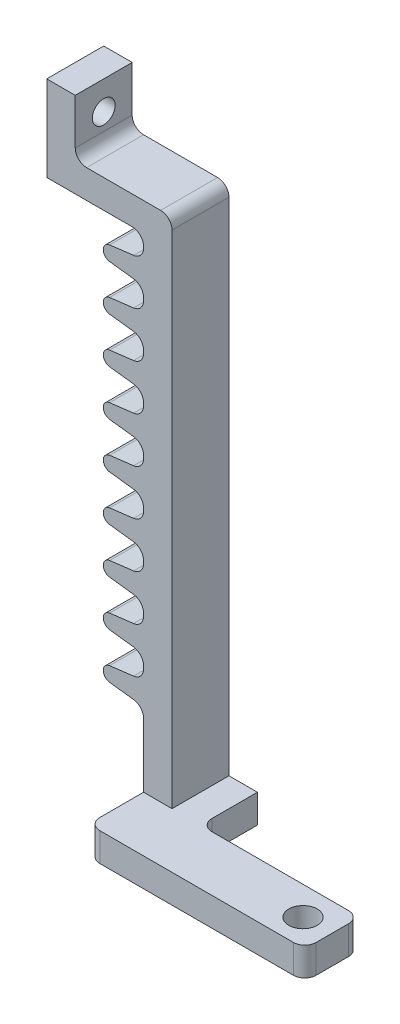
from build123d import *

# Parameters (mm, degrees)
BOSS_EXTRUDE1_DEPTH    = 7
SKETCH2_W              = 5
SKETCH2_H              = 10
BOSS_EXTRUDE2_DEPTH    = 95
SKETCH15_R             = 3.5
CUT_EXTRUDE3_DEPTH     = 7
SKETCH18_W             = 10
SKETCH18_H             = 5
BOSS_EXTRUDE3_DEPTH    = 34
BOSS_EXTRUDE4_DEPTH    = 10
FILLET1_R              = 2
FILLET2_R              = 2
LPATTERN2_COUNT        = 9
LPATTERN2_PITCH        = 8
FILLET1_OF_LPATTERN2_R = 2
SKETCH20_R             = 2.5
CUT_EXTRUDE4_DEPTH     = 10
CIRPATTERN2_COUNT      = 4
SKETCH22_W             = 135.679550384
SKETCH22_H             = 112.96527187
CUT_EXTRUDE5_DEPTH     = 61.740758688
BOSS_EXTRUDE5_START    = 5
SKETCH23_R             = 2.5
BOSS_EXTRUDE5_DEPTH    = 5
CUT_EXTRUDE6_START     = -10
CUT_EXTRUDE6_DEPTH     = 10
SKETCH27_W             = 10
SKETCH27_H             = 5
BOSS_EXTRUDE6_DEPTH    = 5
SKETCH28_W             = 5
SKETCH28_H             = 10
BOSS_EXTRUDE7_DEPTH    = 10
SKETCH29_R             = 2
CUT_EXTRUDE7_DEPTH     = 5
FILLET3_R              = 2


with BuildPart() as part:
    # Sketch1 → Boss-Extrude1 (new body)
    with BuildSketch(Plane(origin=(0, 0, 0), x_dir=(1, 0, 0), z_dir=(0, 1, 0))):
        with BuildLine():
            Line((-8, 56.940758688), (-8, 59.740758688))
            ThreePointArc((-8, 59.740758688), (-7.414213562, 61.154972251), (-6, 61.740758688))
            Line((-6, 61.740758688), (6, 61.740758688))
            ThreePointArc((6, 61.740758688), (7.414213562, 61.154972251), (8, 59.740758688))
            Line((8, 59.740758688), (8, 56.940758688))
            ThreePointArc((8, 56.940758688), (22.004297361, 53.123073119), (34.606342345, 45.920050844))
            Line((34.606342345, 45.920050844), (36.586241332, 47.899949831))
            ThreePointArc((36.586241332, 47.899949831), (38.000454895, 48.485736269), (39.414668457, 47.899949831))
            Line((39.414668457, 47.899949831), (47.899949831, 39.414668457))
            ThreePointArc((47.899949831, 39.414668457), (48.485736269, 38.000454895), (47.899949831, 36.586241332))
            Line((47.899949831, 36.586241332), (45.920050844, 34.606342345))
            ThreePointArc((45.920050844, 34.606342345), (53.123073119, 22.004297361), (56.940758688, 8))
            Line((56.940758688, 8), (59.740758688, 8))
            ThreePointArc((59.740758688, 8), (61.154972251, 7.414213562), (61.740758688, 6))
            Line((61.740758688, 6), (61.740758688, -6))
            ThreePointArc((61.740758688, -6), (61.154972251, -7.414213562), (59.740758688, -8))
            Line((59.740758688, -8), (56.940758688, -8))
            ThreePointArc((56.940758688, -8), (53.123073119, -22.004297361), (45.920050844, -34.606342345))
            Line((45.920050844, -34.606342345), (47.899949831, -36.586241332))
            ThreePointArc((47.899949831, -36.586241332), (48.485736269, -38.000454895), (47.899949831, -39.414668457))
            Line((47.899949831, -39.414668457), (39.414668457, -47.899949831))
            ThreePointArc((39.414668457, -47.899949831), (38.000454895, -48.485736269), (36.586241332, -47.899949831))
            Line((36.586241332, -47.899949831), (34.606342345, -45.920050844))
            ThreePointArc((34.606342345, -45.920050844), (22.004297361, -53.123073119), (8, -56.940758688))
            Line((8, -56.940758688), (8, -59.740758688))
            ThreePointArc((8, -59.740758688), (7.414213562, -61.154972251), (6, -61.740758688))
            Line((6, -61.740758688), (-6, -61.740758688))
            ThreePointArc((-6, -61.740758688), (-7.414213562, -61.154972251), (-8, -59.740758688))
            Line((-8, -59.740758688), (-8, -56.940758688))
            ThreePointArc((-8, -56.940758688), (-22.004297361, -53.123073119), (-34.606342345, -45.920050844))
            Line((-34.606342345, -45.920050844), (-36.586241332, -47.899949831))
            ThreePointArc((-36.586241332, -47.899949831), (-38.000454895, -48.485736269), (-39.414668457, -47.899949831))
            Line((-39.414668457, -47.899949831), (-47.899949831, -39.414668457))
            ThreePointArc((-47.899949831, -39.414668457), (-48.485736269, -38.000454895), (-47.899949831, -36.586241332))
            Line((-47.899949831, -36.586241332), (-45.920050844, -34.606342345))
            ThreePointArc((-45.920050844, -34.606342345), (-53.123073119, -22.004297361), (-56.940758688, -8))
            Line((-56.940758688, -8), (-59.740758688, -8))
            ThreePointArc((-59.740758688, -8), (-61.154972251, -7.414213562), (-61.740758688, -6))
            Line((-61.740758688, -6), (-61.740758688, 6))
            ThreePointArc((-61.740758688, 6), (-61.154972251, 7.414213562), (-59.740758688, 8))
            Line((-59.740758688, 8), (-56.940758688, 8))
            ThreePointArc((-56.940758688, 8), (-53.123073119, 22.004297361), (-45.920050844, 34.606342345))
            Line((-45.920050844, 34.606342345), (-47.899949831, 36.586241332))
            ThreePointArc((-47.899949831, 36.586241332), (-48.485736269, 38.000454895), (-47.899949831, 39.414668457))
            Line((-47.899949831, 39.414668457), (-39.414668457, 47.899949831))
            ThreePointArc((-39.414668457, 47.899949831), (-38.000454895, 48.485736269), (-36.586241332, 47.899949831))
            Line((-36.586241332, 47.899949831), (-34.606342345, 45.920050844))
            ThreePointArc((-34.606342345, 45.920050844), (-22.004297361, 53.123073119), (-8, 56.940758688))
        make_face()
    extrude(amount=BOSS_EXTRUDE1_DEPTH)

    # Sketch2 → Boss-Extrude2 (add)
    with BuildSketch(Plane(origin=(0, 7, 0), x_dir=(1, 0, 0), z_dir=(0, 1, 0))):
        with Locations((19.5, 10)):
            Rectangle(SKETCH2_W, SKETCH2_H)
        with Locations((-19.5, 10)):
            Rectangle(SKETCH2_W, SKETCH2_H)
    extrude(amount=BOSS_EXTRUDE2_DEPTH)

    # Sketch15 → Cut-Extrude3 (cut)
    with BuildSketch(Plane.XZ):
        with Locations(Location((0, 0, 0), (0, 0, 270))):
            Circle(SKETCH15_R)
    extrude(amount=-CUT_EXTRUDE3_DEPTH, mode=Mode.SUBTRACT)

    # Sketch18 → Boss-Extrude3 (add)
    with BuildSketch(Plane(origin=(-17, 0, 0), x_dir=(0, 0, -1), z_dir=(1, 0, 0))):
        with Locations((10, 99.5)):
            Rectangle(SKETCH18_W, SKETCH18_H)
    extrude(amount=BOSS_EXTRUDE3_DEPTH)

    # Sketch19 → Boss-Extrude4 (add)
    with BuildSketch(Plane(origin=(0, 0, -15), x_dir=(-1, 0, 0), z_dir=(0, 0, -1))):
        with BuildLine():
            Line((-17, 93), (-11.04472309, 92.26878394))
            ThreePointArc((-11.04472309, 92.26878394), (-9.922197884, 91), (-11.04472309, 89.73121606))
            Line((-11.04472309, 89.73121606), (-17, 89))
            Line((-17, 89), (-17, 93))
        make_face()
    boss_extrude4 = extrude(amount=-BOSS_EXTRUDE4_DEPTH)

    # Fillet1
    fillet1_edges = [part.edges().sort_by_distance(p)[0] for p in [
        (17, 89, -10),
        (17, 93, -10),
    ]]
    fillet(fillet1_edges, radius=FILLET1_R)

    # Fillet2
    fillet2_edges = [part.edges().sort_by_distance(p)[0] for p in [
        (22, 102, -10),
        (-22, 102, -10),
        (-17, 97, -10),
        (17, 97, -10),
    ]]
    fillet(fillet2_edges, radius=FILLET2_R)

    # LPattern2: Boss-Extrude4 ×9
    with Locations(*[(0, -i * LPATTERN2_PITCH, 0) for i in range(1, LPATTERN2_COUNT)]):
        add(boss_extrude4)

    # Fillet1 of LPattern2
    fillet1_of_lpattern2_edges = [part.edges().sort_by_distance(p)[0] for p in [
        (17, 81, -10),
        (17, 85, -10),
        (17, 73, -10),
        (17, 77, -10),
        (17, 65, -10),
        (17, 69, -10),
        (17, 57, -10),
        (17, 61, -10),
        (17, 49, -10),
        (17, 53, -10),
        (17, 41, -10),
        (17, 45, -10),
        (17, 33, -10),
        (17, 37, -10),
        (17, 25, -10),
        (17, 29, -10),
    ]]
    fillet(fillet1_of_lpattern2_edges, radius=FILLET1_OF_LPATTERN2_R)

    # Sketch20 → Cut-Extrude4 (cut)
    with BuildSketch(Plane(origin=(0, 7, 0), x_dir=(1, 0, 0), z_dir=(0, 1, 0))):
        with Locations(Location((0, 50, 0), (0, 0, 270))):
            Circle(SKETCH20_R)
    cut_extrude4 = extrude(amount=-CUT_EXTRUDE4_DEPTH, mode=Mode.SUBTRACT)

    # CirPattern2: Cut-Extrude4 ×4 about axis
    cirpattern2_axis = Axis((0, 0, 0), (0, 1, 0))
    for i in range(1, CIRPATTERN2_COUNT):
        add(cut_extrude4.rotate(cirpattern2_axis, i * 360 / CIRPATTERN2_COUNT), mode=Mode.SUBTRACT)

    # Sketch22 → Cut-Extrude5 (cut)
    with BuildSketch(Plane(origin=(0, 0, 0), x_dir=(0, 0, -1), z_dir=(1, 0, 0))):
        with Locations((-0.132373771, 50.371775874)):
            Rectangle(SKETCH22_W, SKETCH22_H)
    extrude(amount=-CUT_EXTRUDE5_DEPTH, mode=Mode.SUBTRACT)

    # Sketch23 → Boss-Extrude5 (add)
    with BuildSketch(Plane(origin=(0, 7, 0), x_dir=(1, 0, 0), z_dir=(0, 1, 0)).offset(BOSS_EXTRUDE5_START)):
        with BuildLine():
            Line((55, 3), (55, -2.687123684))
            ThreePointArc((55, -2.687123684), (54.414213562, -4.101337246), (53, -4.687123684))
            Line((53, -4.687123684), (19, -4.687123684))
            ThreePointArc((19, -4.687123684), (17.585786438, -4.101337246), (17, -2.687123684))
            Line((17, -2.687123684), (17, 5))
            Line((17, 5), (53, 5))
            ThreePointArc((53, 5), (54.414213562, 4.414213562), (55, 3))
        make_face()
        with Locations(Location((50, 0, 0), (0, 0, 270))):
            Circle(SKETCH23_R, mode=Mode.SUBTRACT)
    extrude(amount=-BOSS_EXTRUDE5_DEPTH)

    # Sketch26 → Cut-Extrude6 (cut)
    with BuildSketch(Plane(origin=(0, 7, 0), x_dir=(1, 0, 0), z_dir=(0, 1, 0)).offset(CUT_EXTRUDE6_START)):
        with BuildLine():
            Line((6, 61.740758688), (0, 61.740758688))
            Line((0, 61.740758688), (0, 52.5))
            ThreePointArc((0, 52.5), (2.5, 50), (0, 47.5))
            Line((0, 47.5), (0, 3.5))
            ThreePointArc((0, 3.5), (3.5, 0), (0, -3.5))
            Line((0, -3.5), (0, -47.5))
            ThreePointArc((0, -47.5), (2.5, -50), (0, -52.5))
            Line((0, -52.5), (0, -61.740758688))
            Line((0, -61.740758688), (6, -61.740758688))
            ThreePointArc((6, -61.740758688), (7.414213562, -61.154972251), (8, -59.740758688))
            Line((8, -59.740758688), (8, -56.940758688))
            ThreePointArc((8, -56.940758688), (22.004297361, -53.123073119), (34.606342345, -45.920050844))
            Line((34.606342345, -45.920050844), (36.586241332, -47.899949831))
            ThreePointArc((36.586241332, -47.899949831), (38.000454895, -48.485736269), (39.414668457, -47.899949831))
            Line((39.414668457, -47.899949831), (47.899949831, -39.414668457))
            ThreePointArc((47.899949831, -39.414668457), (48.485736269, -38.000454895), (47.899949831, -36.586241332))
            Line((47.899949831, -36.586241332), (45.920050844, -34.606342345))
            ThreePointArc((45.920050844, -34.606342345), (53.123073119, -22.004297361), (56.940758688, -8))
            Line((56.940758688, -8), (59.740758688, -8))
            ThreePointArc((59.740758688, -8), (61.154972251, -7.414213562), (61.740758688, -6))
            Line((61.740758688, -6), (61.740758688, 6))
            ThreePointArc((61.740758688, 6), (61.154972251, 7.414213562), (59.740758688, 8))
            Line((59.740758688, 8), (56.940758688, 8))
            ThreePointArc((56.940758688, 8), (53.123073119, 22.004297361), (45.920050844, 34.606342345))
            Line((45.920050844, 34.606342345), (47.899949831, 36.586241332))
            ThreePointArc((47.899949831, 36.586241332), (48.485736269, 38.000454895), (47.899949831, 39.414668457))
            Line((47.899949831, 39.414668457), (39.414668457, 47.899949831))
            ThreePointArc((39.414668457, 47.899949831), (38.000454895, 48.485736269), (36.586241332, 47.899949831))
            Line((36.586241332, 47.899949831), (34.606342345, 45.920050844))
            ThreePointArc((34.606342345, 45.920050844), (22.004297361, 53.123073119), (8, 56.940758688))
            Line((8, 56.940758688), (8, 59.740758688))
            ThreePointArc((8, 59.740758688), (7.414213562, 61.154972251), (6, 61.740758688))
        make_face()
    extrude(amount=CUT_EXTRUDE6_DEPTH, mode=Mode.SUBTRACT)

    # Sketch27 → Boss-Extrude6 (add)
    with BuildSketch(Plane(origin=(22, 0, 0), x_dir=(0, 0, -1), z_dir=(1, 0, 0))):
        with Locations((10, 9.5)):
            Rectangle(SKETCH27_W, SKETCH27_H)
    extrude(amount=BOSS_EXTRUDE6_DEPTH)

    # Sketch28 → Boss-Extrude7 (add)
    with BuildSketch(Plane(origin=(0, 102, 0), x_dir=(1, 0, 0), z_dir=(0, 1, 0))):
        with Locations((2.5, 10)):
            Rectangle(SKETCH28_W, SKETCH28_H)
    extrude(amount=BOSS_EXTRUDE7_DEPTH)

    # Sketch29 → Cut-Extrude7 (cut)
    with BuildSketch(Plane(origin=(5, 0, 0), x_dir=(0, 0, -1), z_dir=(1, 0, 0))):
        with Locations((10, 107)):
            Circle(SKETCH29_R)
    extrude(amount=-CUT_EXTRUDE7_DEPTH, mode=Mode.SUBTRACT)

    # Fillet3
    fillet3_edges = [part.edges().sort_by_distance(p)[0] for p in [
        (27, 9.5, -5),
        (5, 102, -10),
    ]]
    fillet(fillet3_edges, radius=FILLET3_R)


solid = part.part
